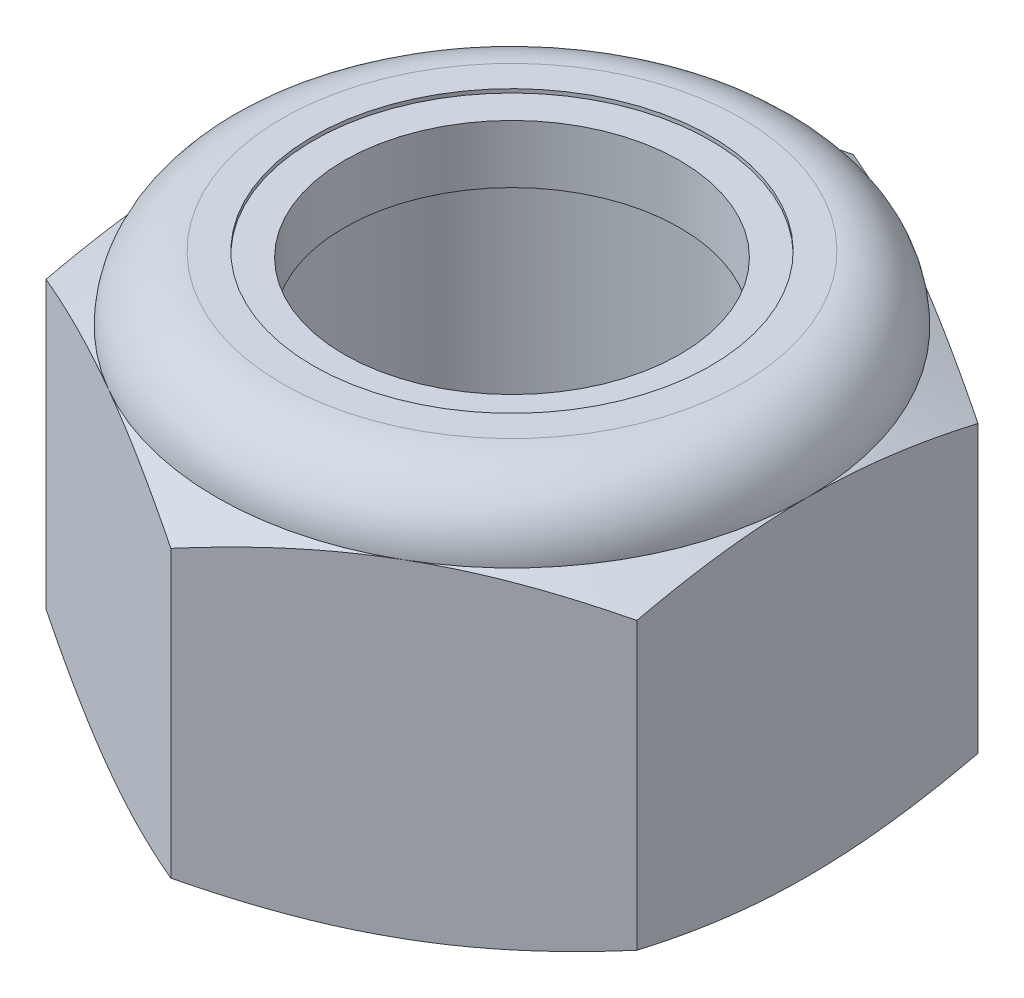
from build123d import *

# Parameters (mm, degrees)
SKETCH1_R      = 8
EXTRUDE1_DEPTH = 16
CHAMFER1_SIZE  = 0.8


with BuildPart() as part:
    # Sketch1 → Extrude1 (new body)
    with BuildSketch(Plane(origin=(0, 0, 0), x_dir=(1, 0, 0), z_dir=(0, 1, 0))):
        Polygon((0, 13.856406461), (-12, 6.92820323), (-12, -6.92820323), (0, -13.856406461), (12, -6.92820323), (12, 6.92820323), align=None)
        Circle(SKETCH1_R, mode=Mode.SUBTRACT)
    extrude(amount=EXTRUDE1_DEPTH)

    # Chamfer1
    chamfer1_edges = [part.edges().sort_by_distance(p)[0] for p in [
        (-8, 0, 0),
    ]]
    chamfer(chamfer1_edges, length=CHAMFER1_SIZE)

    # Sketch5 → Cut-Revolve3 (revolve, cut)
    with BuildSketch(Plane(origin=(0, 0, 0), x_dir=(0, 0, -1), z_dir=(1, 0, 0))):
        with BuildLine():
            Line((0, 0), (12, 0))
            Line((12, 0), (13.856406461, 0.865656549))
            Line((13.856406461, 0.865656549), (13.856406461, 12.467676784))
            Line((13.856406461, 12.467676784), (12, 13.333333333))
            ThreePointArc((12, 13.333333333), (11.218951416, 15.218951416), (9.333333333, 16))
            Line((9.333333333, 16), (9.333333333, 17.27))
            Line((9.333333333, 17.27), (15.126406461, 17.27))
            Line((15.126406461, 17.27), (15.126406461, -1.27))
            Line((15.126406461, -1.27), (0, -1.27))
            Line((0, -1.27), (0, 0))
        make_face()
    revolve(axis=Axis((0, 0, 0), (0, 1, 0)), mode=Mode.SUBTRACT)

    # Sketch6 → Cut-Revolve4 (revolve, cut)
    with BuildSketch(Plane(origin=(0, 0, 0), x_dir=(0, 0, -1), z_dir=(1, 0, 0))):
        with BuildLine():
            Line((0, 13.333333333), (11.8476, 13.333333333))
            ThreePointArc((11.8476, 13.333333333), (11.111188343, 15.111188343), (9.333333333, 15.8476))
            Line((9.333333333, 15.8476), (8.0762, 15.8476))
            Line((8.0762, 15.8476), (8.0762, 17.27))
            Line((8.0762, 17.27), (0, 17.27))
            Line((0, 17.27), (0, 13.333333333))
        make_face()
    revolve(axis=Axis((0, 17.27, 0), (0, -1, 0)), mode=Mode.SUBTRACT)


with BuildPart() as body_2:
    # Sketch7 → Revolve2 (revolve)
    with BuildSketch(Plane(origin=(0, 0, 0), x_dir=(0, 0, -1), z_dir=(1, 0, 0))):
        with BuildLine():
            Line((6.819066667, 13.409533333), (11.770208921, 13.409533333))
            ThreePointArc((11.770208921, 13.409533333), (11.030152179, 15.084040298), (9.333333333, 15.7714))
            Line((9.333333333, 15.7714), (6.819066667, 15.7714))
            Line((6.819066667, 15.7714), (6.819066667, 13.409533333))
        make_face()
    revolve(axis=Axis((0, 13.409533333, 0), (0, 1, 0)))


solid = Compound([part.part, body_2.part])
